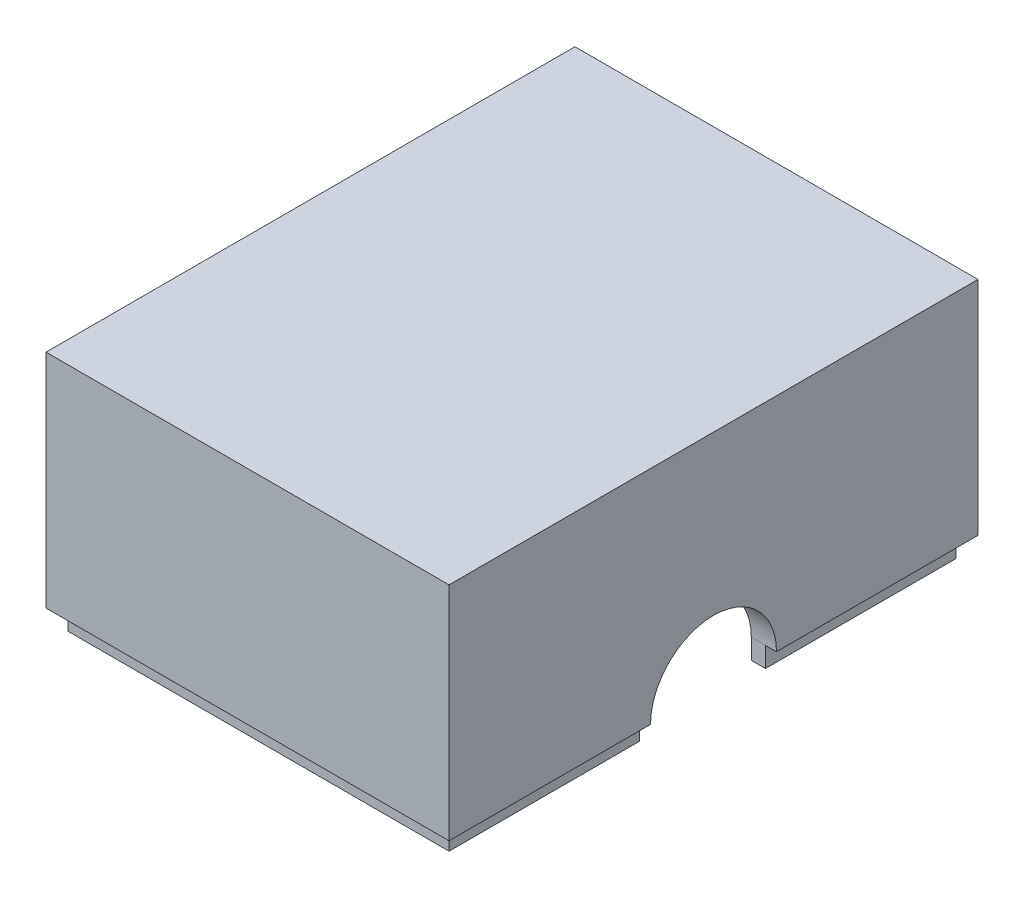
from build123d import *

# Parameters (mm, degrees)
SKETCH1_W           = 80
SKETCH1_H           = 105
BOSS_EXTRUDE1_DEPTH = 48
SKETCH3_W           = 70
SKETCH3_H           = 95
CUT_EXTRUDE1_DEPTH  = 45
SKETCH4_W           = 80
SKETCH4_H           = 105
SKETCH4_W_2         = 75.6
SKETCH4_H_2         = 100.6
CUT_EXTRUDE2_DEPTH  = 4
CUT_EXTRUDE3_DEPTH  = 108.052557186


with BuildPart() as part:
    # Sketch1 → Boss-Extrude1 (new body)
    with BuildSketch(Plane(origin=(0, 0, 0), x_dir=(1, 0, 0), z_dir=(0, 1, 0))):
        Rectangle(SKETCH1_W, SKETCH1_H)
    extrude(amount=BOSS_EXTRUDE1_DEPTH)

    # Sketch3 → Cut-Extrude1 (cut)
    with BuildSketch(Plane.XZ):
        Rectangle(SKETCH3_W, SKETCH3_H)
    extrude(amount=-CUT_EXTRUDE1_DEPTH, mode=Mode.SUBTRACT)

    # Sketch4 → Cut-Extrude2 (cut)
    with BuildSketch(Plane.XZ):
        Rectangle(SKETCH4_W, SKETCH4_H)
        Rectangle(SKETCH4_W_2, SKETCH4_H_2, mode=Mode.SUBTRACT)
    extrude(amount=-CUT_EXTRUDE2_DEPTH, mode=Mode.SUBTRACT)

    # Sketch5 → Cut-Extrude3 (cut, through all)
    with BuildSketch(Plane(origin=(40, 0, 0), x_dir=(0, 0, -1), z_dir=(1, 0, 0))):
        with BuildLine():
            Line((-12.5, 4), (-12.5, -5.5))
            Line((-12.5, -5.5), (12.5, -5.5))
            Line((12.5, -5.5), (12.5, 4))
            ThreePointArc((12.5, 4), (0, 16.5), (-12.5, 4))
        make_face()
    extrude(amount=-CUT_EXTRUDE3_DEPTH, mode=Mode.SUBTRACT)


solid = part.part
